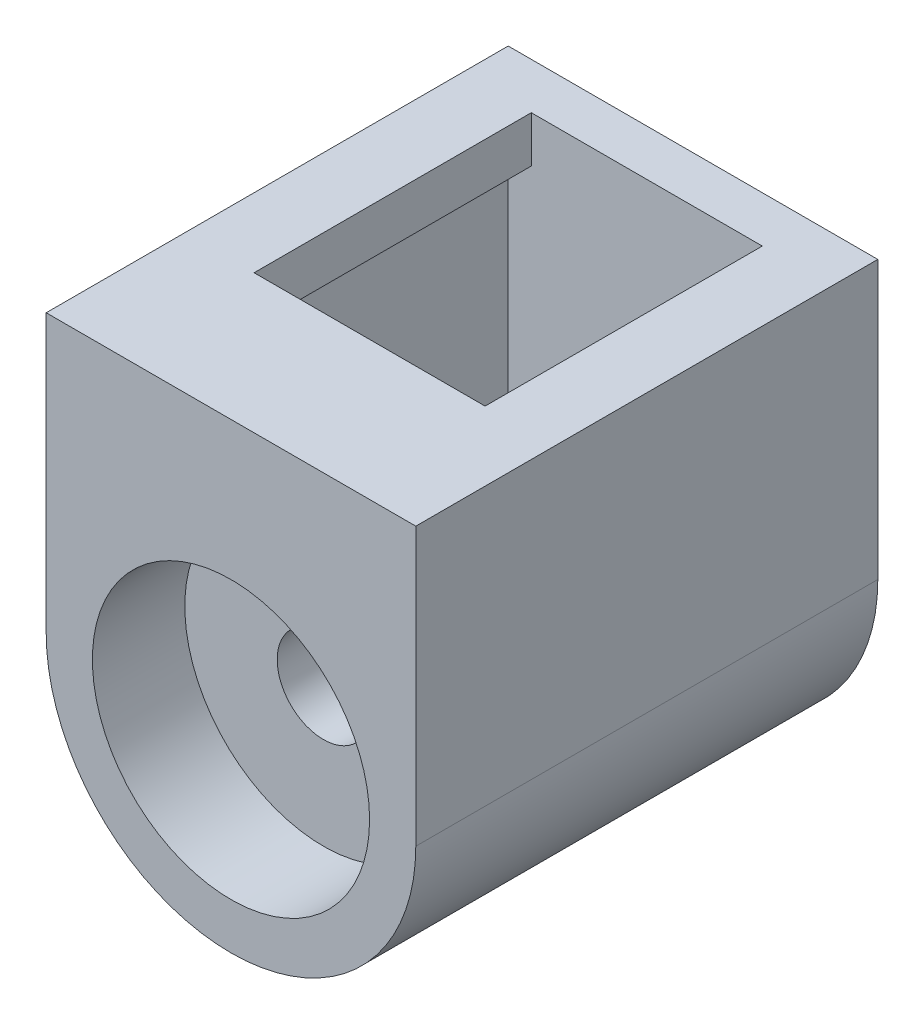
from build123d import *

# Parameters (mm, degrees)
SKETCH1_R           = 7.5
BOSS_EXTRUDE1_DEPTH = 10
BOSS_EXTRUDE2_DEPTH = 50
SKETCH3_R           = 15
CUT_EXTRUDE1_DEPTH  = 10
CUT_EXTRUDE2_START  = -30
CUT_EXTRUDE2_DEPTH  = 30
SKETCH6_W           = 25
SKETCH6_H           = 30
CUT_EXTRUDE3_DEPTH  = 30
SKETCH7_R           = 5
CUT_EXTRUDE4_DEPTH  = 30
SKETCH8_R           = 5.1
CUT_EXTRUDE5_DEPTH  = 5
SKETCH9_R           = 1.5
CUT_EXTRUDE6_DEPTH  = 71
CIRPATTERN1_COUNT   = 2
CIRPATTERN1_ANGLE   = 90


with BuildPart() as part:
    # Sketch1 → Boss-Extrude1 (new body)
    with BuildSketch(Plane.XY):
        Circle(SKETCH1_R)
    extrude(amount=BOSS_EXTRUDE1_DEPTH)

    # Sketch2 → Boss-Extrude2 (add)
    with BuildSketch(Plane.XY.offset(10)):
        with BuildLine():
            Line((20, 0), (20, 30))
            Line((20, 30), (-20, 30))
            Line((-20, 30), (-20, 0))
            ThreePointArc((-20, 0), (0, -20), (20, 0))
        make_face()
    extrude(amount=BOSS_EXTRUDE2_DEPTH)

    # Sketch3 → Cut-Extrude1 (cut)
    with BuildSketch(Plane.XY.offset(60)):
        Circle(SKETCH3_R)
    extrude(amount=-CUT_EXTRUDE1_DEPTH, mode=Mode.SUBTRACT)

    # Sketch5 → Cut-Extrude2 (cut)
    with BuildSketch(Plane(origin=(0, 0, 15), x_dir=(-1, 0, 0), z_dir=(0, 0, -1)).offset(CUT_EXTRUDE2_START)):
        with BuildLine():
            Line((15, 25), (-15, 25))
            Line((-15, 25), (-15, 0))
            ThreePointArc((-15, 0), (0, -15), (15, 0))
            Line((15, 0), (15, 25))
        make_face()
    extrude(amount=CUT_EXTRUDE2_DEPTH, mode=Mode.SUBTRACT)

    # Sketch6 → Cut-Extrude3 (cut)
    with BuildSketch(Plane(origin=(0, 30, 0), x_dir=(1, 0, 0), z_dir=(0, 1, 0))):
        with Locations((0, -30)):
            Rectangle(SKETCH6_W, SKETCH6_H)
    extrude(amount=-CUT_EXTRUDE3_DEPTH, mode=Mode.SUBTRACT)

    # Sketch7 → Cut-Extrude4 (cut)
    with BuildSketch(Plane.XY.offset(50)):
        Circle(SKETCH7_R)
    extrude(amount=-CUT_EXTRUDE4_DEPTH, mode=Mode.SUBTRACT)

    # Sketch8 → Cut-Extrude5 (cut)
    with BuildSketch(Plane(origin=(0, 0, 0), x_dir=(-1, 0, 0), z_dir=(0, 0, -1))):
        Circle(SKETCH8_R)
    extrude(amount=-CUT_EXTRUDE5_DEPTH, mode=Mode.SUBTRACT)

    # Sketch9 → Cut-Extrude6 (cut, symmetric)
    with BuildSketch(Plane(origin=(0, 0, 0), x_dir=(1, 0, 0), z_dir=(0, 1, 0))):
        with Locations(Location((0, -2.5, 0), (0, 0, 270))):
            Circle(SKETCH9_R)
    cut_extrude6 = extrude(amount=CUT_EXTRUDE6_DEPTH, both=True, mode=Mode.SUBTRACT)

    # CirPattern1: Cut-Extrude6 ×2 about axis
    cirpattern1_axis = Axis((0, 0, 0), (0, 0, 1))
    for i in range(1, CIRPATTERN1_COUNT):
        add(cut_extrude6.rotate(cirpattern1_axis, i * CIRPATTERN1_ANGLE / (CIRPATTERN1_COUNT - 1)), mode=Mode.SUBTRACT)


solid = part.part
